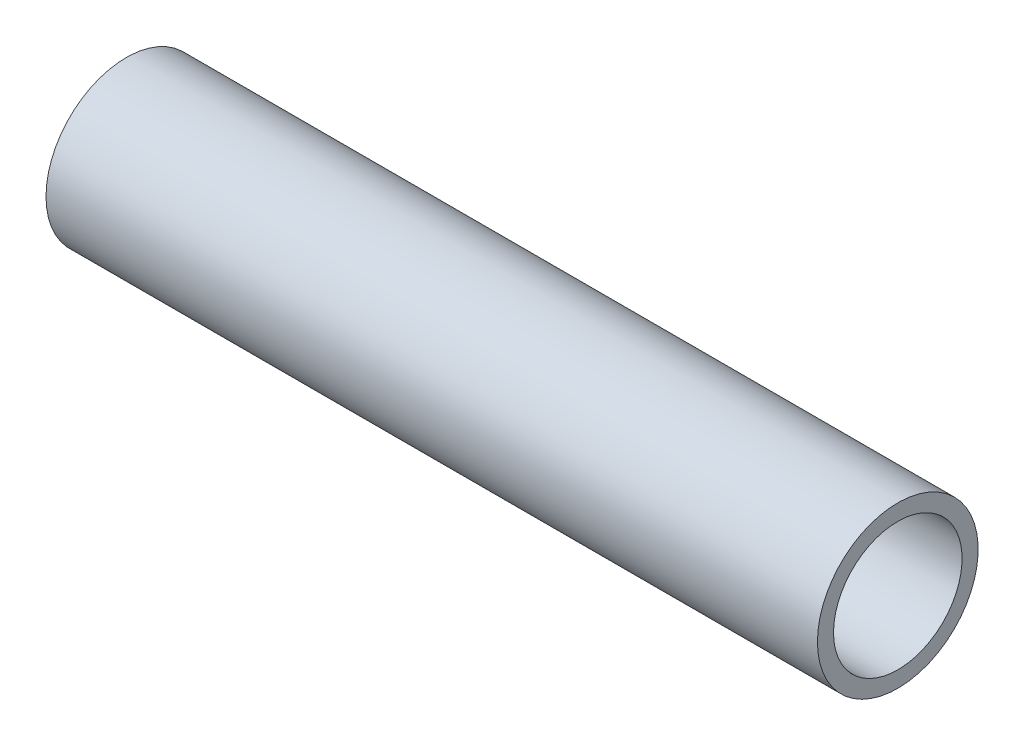
from build123d import *

# Parameters (mm, degrees)
SKETCH1_R           = 7.9375
SKETCH1_R_2         = 6.35
BOSS_EXTRUDE1_DEPTH = 76.2


with BuildPart() as part:
    # Sketch1 → Boss-Extrude1 (new body)
    with BuildSketch(Plane(origin=(0, 0, 0), x_dir=(0, 0, -1), z_dir=(1, 0, 0))):
        with Locations(Location((0, 0, 0), (0, 0, 180))):
            Circle(SKETCH1_R)
        with Locations(Location((0, 0, 0), (0, 0, 180))):
            Circle(SKETCH1_R_2, mode=Mode.SUBTRACT)
    extrude(amount=BOSS_EXTRUDE1_DEPTH)


solid = part.part
